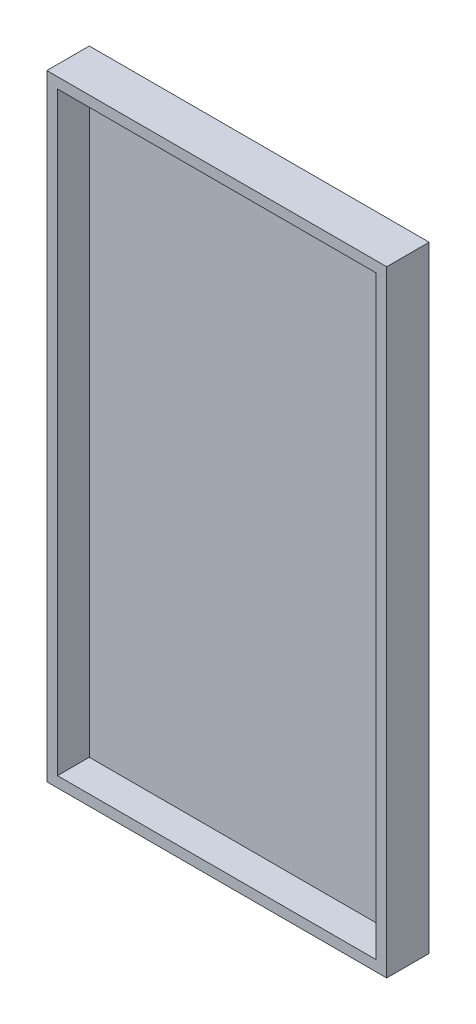
from build123d import *

# Parameters (mm, degrees)
SKETCH1_W           = 32
SKETCH1_H           = 58
BOSS_EXTRUDE1_DEPTH = 2
SHELL1_T            = -1


with BuildPart() as part:
    # Sketch1 → Boss-Extrude1 (new, symmetric)
    with BuildSketch(Plane.XY):
        Rectangle(SKETCH1_W, SKETCH1_H)
    extrude(amount=BOSS_EXTRUDE1_DEPTH, both=True)

    # Shell1
    shell1_openings = [part.faces().sort_by_distance(p)[0] for p in [
        (0, 0, 2),
    ]]
    offset(amount=SHELL1_T, openings=shell1_openings, kind=Kind.INTERSECTION)


solid = part.part
